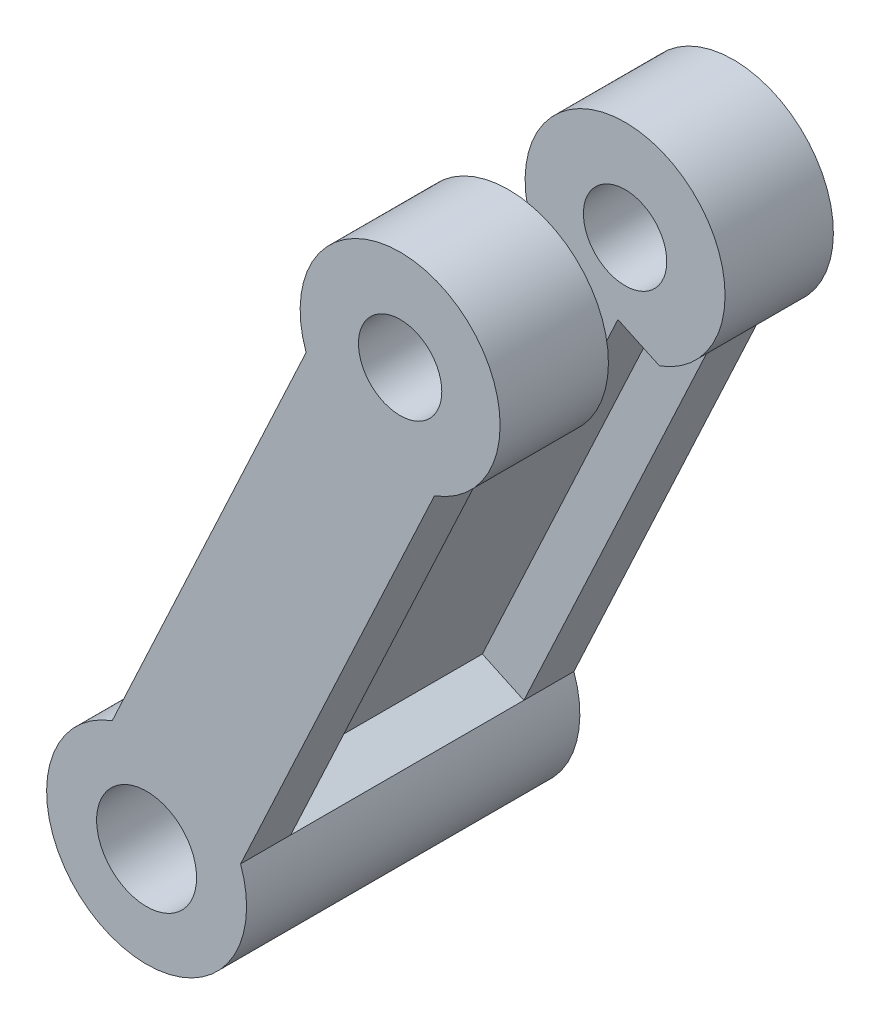
from build123d import *

# Parameters (mm, degrees)
BOSS_EXTRUDE1_DEPTH     = 100
CUT_EXTRUDE1_DEPTH      = 452.895569028
CUT_EXTRUDE1_DEPTH_BACK = 452.895569028
SKETCH2_R               = 30
SKETCH2_R_2             = 25
SKETCH9_R               = 60
CUT_EXTRUDE4_DEPTH      = 35
CUT_EXTRUDE5_DEPTH      = 457.59902747
SKETCH12_W              = 140
SKETCH12_H              = 275.29462827
CUT_EXTRUDE6_DEPTH      = 27.5
SCALE1_SCALE            = 0.1


with BuildPart() as part:
    # Sketch1 → Boss-Extrude1 (new, symmetric)
    with BuildSketch(Plane.XY):
        with BuildLine():
            Line((56.417099429, 20.423292878), (172.761636695, 269.924958208))
            ThreePointArc((172.761636695, 269.924958208), (177.499669931, 380.649270555), (95.725474797, 305.847510456))
            Line((95.725474797, 305.847510456), (-20.619062469, 56.345845126))
            ThreePointArc((-20.619062469, 56.345845126), (-25.357095704, -54.378467222), (56.417099429, 20.423292878))
        make_face()
    extrude(amount=BOSS_EXTRUDE1_DEPTH, both=True)

    # Sketch2 → Cut-Extrude1 (cut, two sides: drawn at the far end of the back side and taken through both)
    with BuildSketch(Plane.XY.offset(-CUT_EXTRUDE1_DEPTH_BACK)):
        Circle(SKETCH2_R)
        with Locations((152.142574227, 326.270803333)):
            Circle(SKETCH2_R_2)
    extrude(amount=CUT_EXTRUDE1_DEPTH + CUT_EXTRUDE1_DEPTH_BACK, mode=Mode.SUBTRACT)

    # Sketch9 → Cut-Extrude4 (cut, symmetric)
    with BuildSketch(Plane.XY):
        with Locations((152.142574227, 326.270803333)):
            Circle(SKETCH9_R)
    extrude(amount=CUT_EXTRUDE4_DEPTH, both=True, mode=Mode.SUBTRACT)

    # Sketch10 → Cut-Extrude5 (cut, through all)
    with BuildSketch(Plane(origin=(-38.518080949, 17.961276124, 0), x_dir=(0, 0, 1), z_dir=(-0.906307787036651, 0.42261826174069733, 0))):
        with BuildLine():
            Line((-35, 317.647314135), (-35, 272.647314135))
            ThreePointArc((-35, 272.647314135), (-32.071067812, 265.576246323), (-25, 262.647314135))
            Line((-25, 262.647314135), (0, 262.647314135))
            Line((0, 262.647314135), (25, 262.647314135))
            ThreePointArc((25, 262.647314135), (32.071067812, 265.576246323), (35, 272.647314135))
            Line((35, 272.647314135), (35, 317.647314135))
            Line((35, 317.647314135), (-35, 317.647314135))
        make_face()
    extrude(amount=-CUT_EXTRUDE5_DEPTH, mode=Mode.SUBTRACT)

    # Sketch12 → Cut-Extrude6 (cut)
    with BuildSketch(Plane(origin=(-38.518080949, 17.961276124, 0), x_dir=(0, 0, 1), z_dir=(-0.906307787036651, 0.42261826174069733, 0))):
        with Locations((0, 180)):
            Rectangle(SKETCH12_W, SKETCH12_H)
    cut_extrude6 = extrude(amount=-CUT_EXTRUDE6_DEPTH, mode=Mode.SUBTRACT)

    # Mirror1: Cut-Extrude6 across plane
    add(cut_extrude6.mirror(Plane(origin=(0, 0, 0), x_dir=(0, 0, 1), z_dir=(-0.906307787036651, 0.42261826174069733, 0))), mode=Mode.SUBTRACT)


with BuildPart() as part_1:
    # Scale1: scaled about (68.503201219, 146.905589092, 0)
    add(part.part.scale(SCALE1_SCALE).moved(Location((61.652881097, 132.215030183, 0))))


solid = part_1.part
